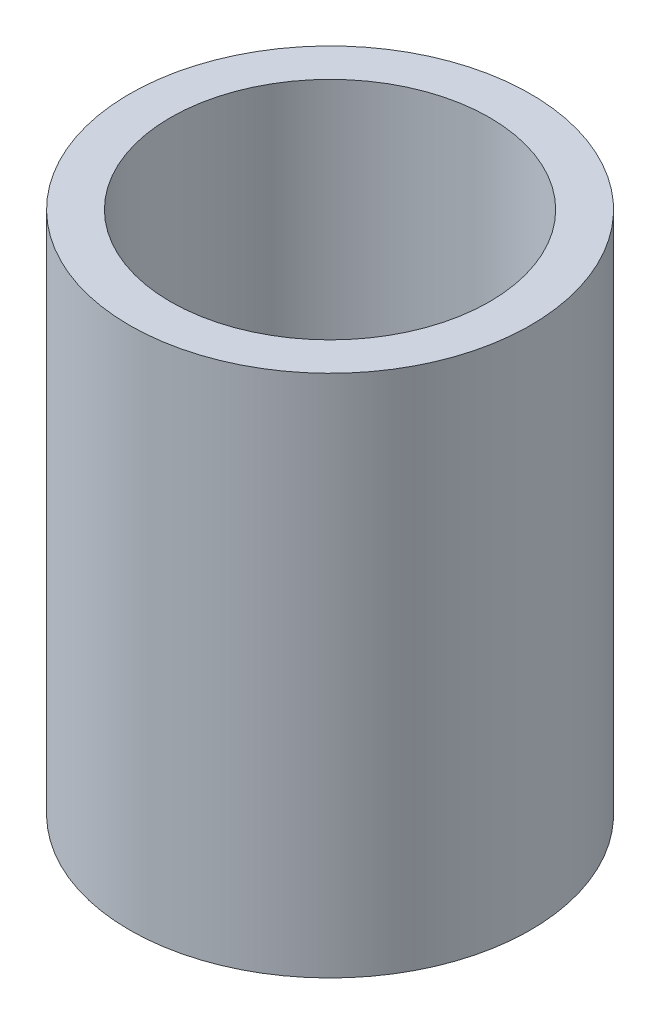
from build123d import *

# Parameters (mm, degrees)
SKETCH1_R           = 24.5
SKETCH1_R_2         = 19.5
BOSS_EXTRUDE1_DEPTH = 32


with BuildPart() as part:
    # Sketch1 → Boss-Extrude1 (new, symmetric)
    with BuildSketch(Plane(origin=(0, 0, 0), x_dir=(1, 0, 0), z_dir=(0, 1, 0))):
        with Locations(Location((0, 0, 0), (0, 0, 270))):
            Circle(SKETCH1_R)
        with Locations(Location((0, 0, 0), (0, 0, 270))):
            Circle(SKETCH1_R_2, mode=Mode.SUBTRACT)
    extrude(amount=BOSS_EXTRUDE1_DEPTH, both=True)


solid = part.part
